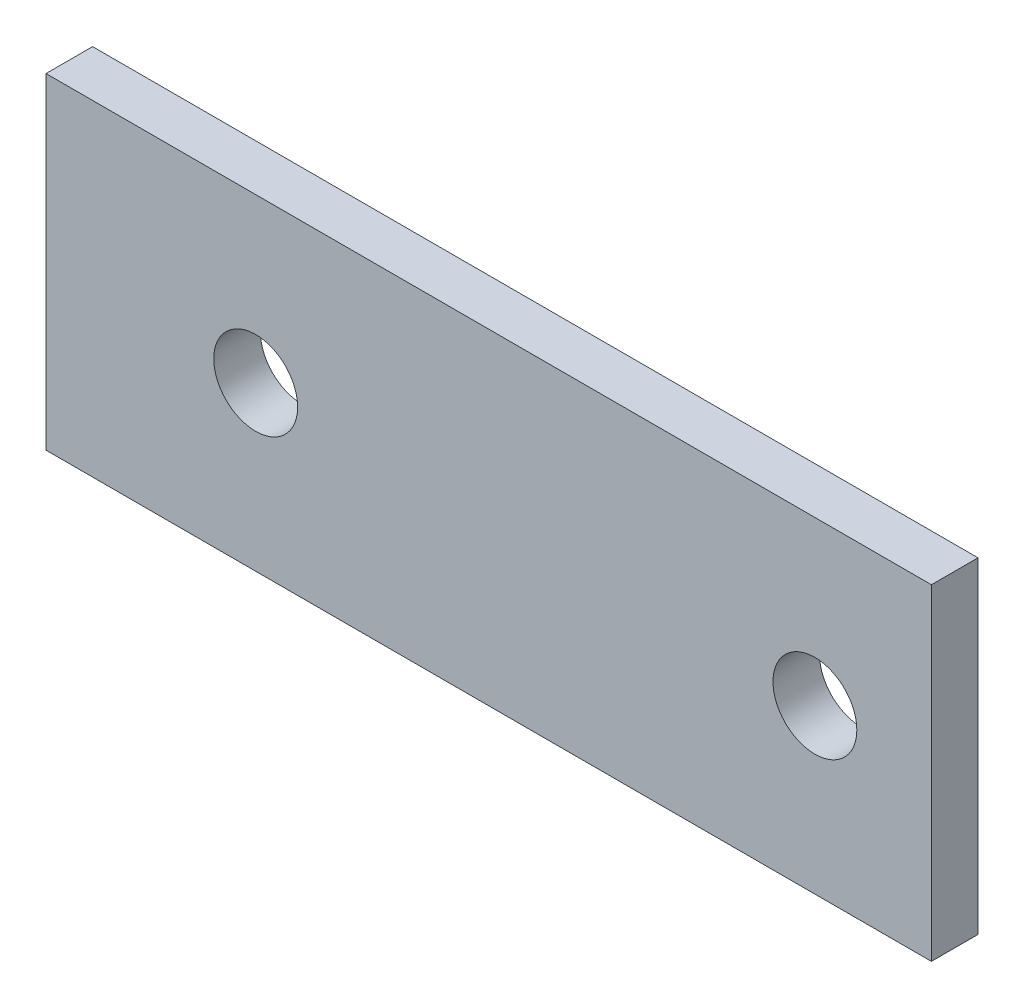
from build123d import *

# Parameters (mm, degrees)
SKETCH1_W           = 190
SKETCH1_H           = 70
SKETCH1_R           = 9
BOSS_EXTRUDE1_DEPTH = 5


with BuildPart() as part:
    # Sketch1 → Boss-Extrude1 (new, symmetric)
    with BuildSketch(Plane.XY):
        Rectangle(SKETCH1_W, SKETCH1_H)
        with Locations((70, 0)):
            Circle(SKETCH1_R, mode=Mode.SUBTRACT)
        with Locations((-50, 0)):
            Circle(SKETCH1_R, mode=Mode.SUBTRACT)
    extrude(amount=BOSS_EXTRUDE1_DEPTH, both=True)


solid = part.part
